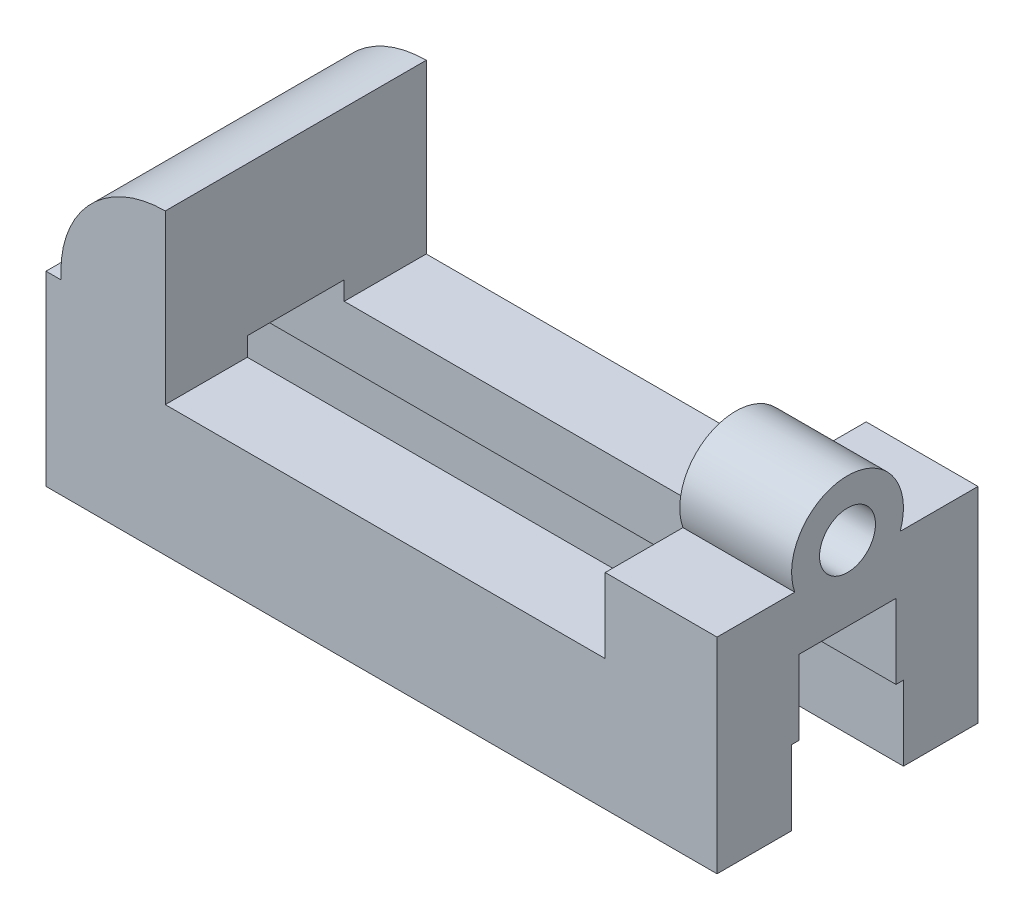
from build123d import *

# Parameters (mm, degrees)
BOSS_EXTRUDE1_DEPTH = 70
CUT_EXTRUDE3_DEPTH  = 196
SKETCH5_R           = 15
BOSS_EXTRUDE3_DEPTH = 30
CUT_EXTRUDE4_DEPTH  = 30


with BuildPart() as part:
    # Sketch1 → Boss-Extrude1 (new body)
    with BuildSketch(Plane.XY):
        with BuildLine():
            Line((0, 0), (180, 0))
            Line((180, 0), (180, 55))
            Line((180, 55), (150, 55))
            Line((150, 55), (150, 35))
            Line((150, 35), (32, 35))
            Line((32, 35), (32, 80))
            ThreePointArc((32, 80), (12.200980837, 71.799019163), (4, 52.0001))
            Line((4, 52.0001), (4, 50))
            Line((4, 50), (0, 50))
            Line((0, 50), (0, 0))
        make_face()
    extrude(amount=-BOSS_EXTRUDE1_DEPTH)

    # Sketch2 → Cut-Extrude3 (cut)
    with BuildSketch(Plane.ZY):
        Polygon((-50, 0), (-50, 20), (-48, 20), (-48, 40), (-22, 40), (-22, 20), (-20, 20), (-20, 0), align=None)
    extrude(amount=-CUT_EXTRUDE3_DEPTH, mode=Mode.SUBTRACT)

    # Sketch5 → Boss-Extrude3 (add)
    with BuildSketch(Plane.ZY.offset(-180)):
        with Locations((-35, 60)):
            Circle(SKETCH5_R)
        with BuildLine():
            ThreePointArc((-27.5, 60), (-27.993707308, 57.323834327), (-29.409830056, 55))
            ThreePointArc((-29.409830056, 55), (-35, 52.5), (-40.590169944, 55))
            ThreePointArc((-40.590169944, 55), (-37.676165673, 67.006292692), (-27.5, 60))
        make_face(mode=Mode.SUBTRACT)
    extrude(amount=BOSS_EXTRUDE3_DEPTH)

    # Sketch5<3> → Cut-Extrude4 (cut)
    with BuildSketch(Plane.ZY.offset(-180)):
        with BuildLine():
            ThreePointArc((-40.590169944, 55), (-35, 52.5), (-29.409830056, 55))
            Line((-29.409830056, 55), (-40.590169944, 55))
        make_face()
    extrude(amount=CUT_EXTRUDE4_DEPTH, mode=Mode.SUBTRACT)


solid = part.part
